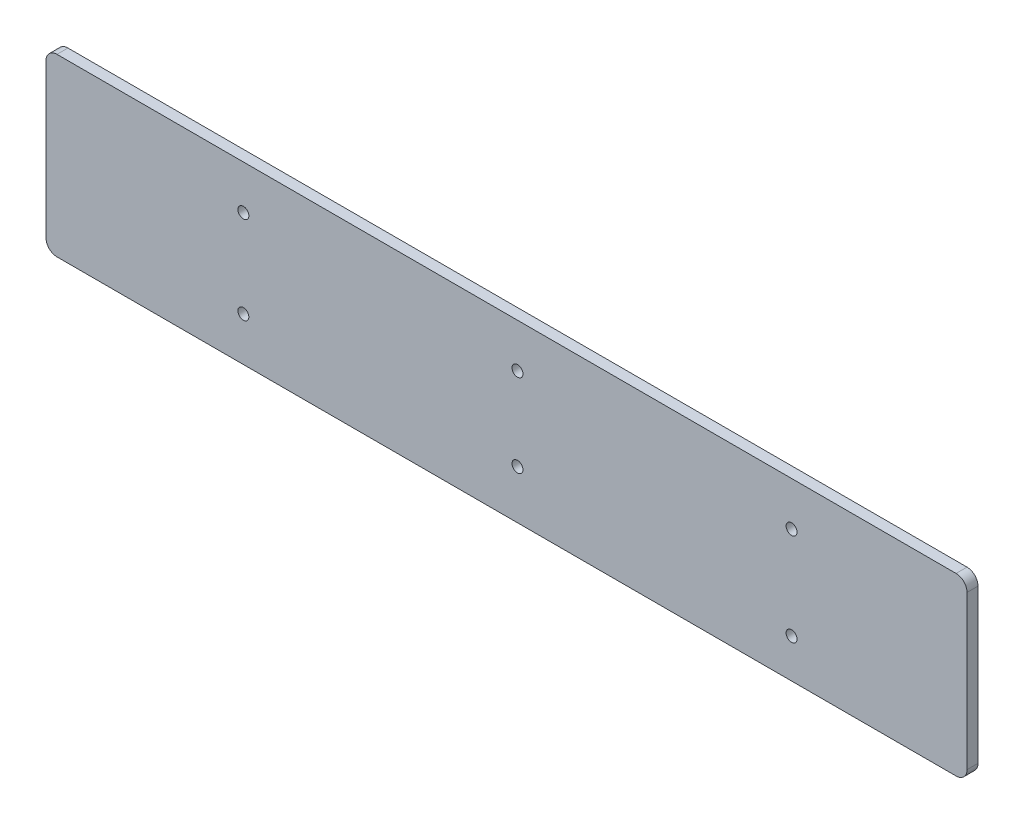
from build123d import *

# Parameters (mm, degrees)
SKETCH1_W           = 420
SKETCH1_H           = 80
SKETCH1_R           = 2.5
BOSS_EXTRUDE1_DEPTH = 5
FILLET1_R           = 5


with BuildPart() as part:
    # Sketch1 → Boss-Extrude1 (new body)
    with BuildSketch(Plane.XY):
        with Locations((-2.490697888, -11.144221335)):
            Rectangle(SKETCH1_W, SKETCH1_H)
        with Locations((-122.490697888, -31.144221335)):
            Circle(SKETCH1_R, mode=Mode.SUBTRACT)
        with Locations((-122.490697888, 8.855778665)):
            Circle(SKETCH1_R, mode=Mode.SUBTRACT)
        with Locations((2.509302112, 8.855778665)):
            Circle(SKETCH1_R, mode=Mode.SUBTRACT)
        with Locations((2.509302112, -28.978769478)):
            Circle(SKETCH1_R, mode=Mode.SUBTRACT)
        with Locations((127.509302112, 8.855778665)):
            Circle(SKETCH1_R, mode=Mode.SUBTRACT)
        with Locations((127.509302112, -33.361178677)):
            Circle(SKETCH1_R, mode=Mode.SUBTRACT)
    extrude(amount=BOSS_EXTRUDE1_DEPTH)

    # Fillet1
    fillet1_edges = [part.edges().sort_by_distance(p)[0] for p in [
        (-212.490697888, 28.855778665, 2.5),
        (207.509302112, 28.855778665, 2.5),
        (207.509302112, -51.144221335, 2.5),
        (-212.490697888, -51.144221335, 2.5),
    ]]
    fillet(fillet1_edges, radius=FILLET1_R)


solid = part.part
